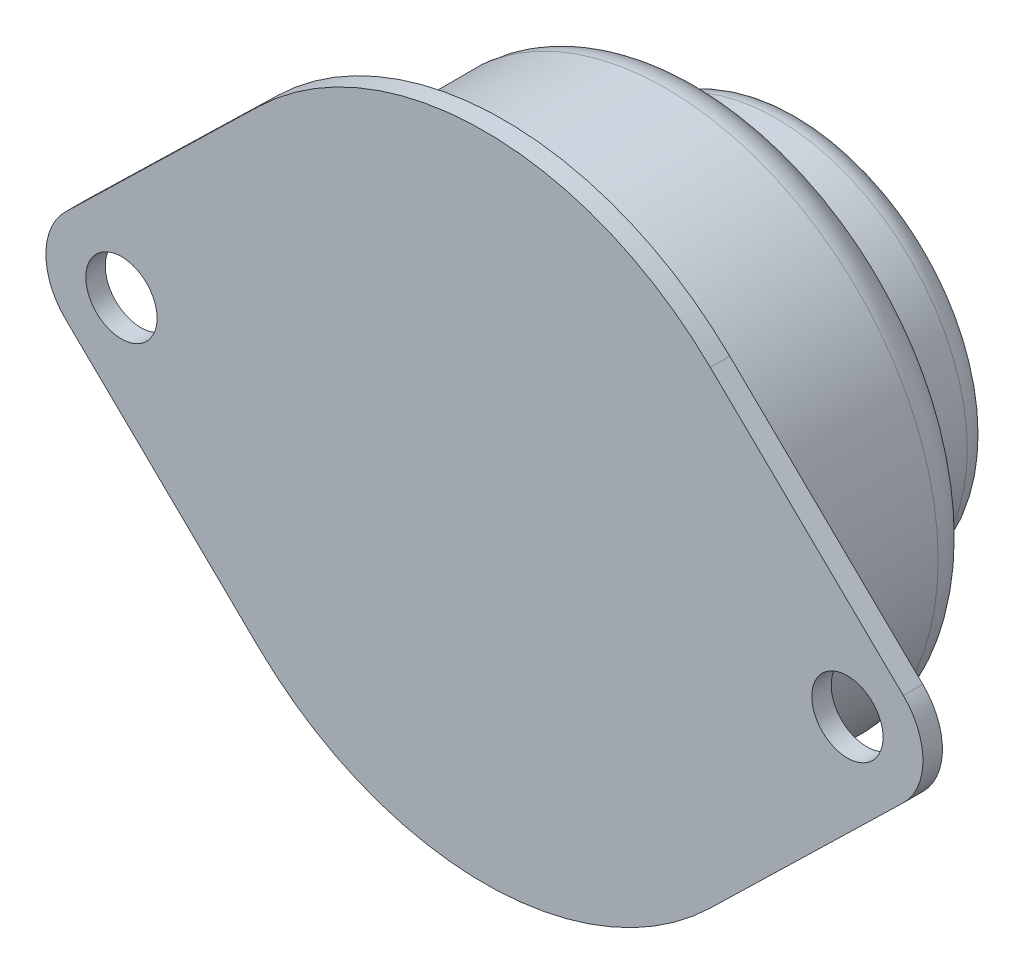
from build123d import *

# Parameters (mm, degrees)
SKETCH_2_R      = 2.75
EXTRUDE_1_DEPTH = 1.5
SKETCH_3_R      = 21
EXTRUDE_2_DEPTH = 17
FILLET_4_R      = 3
SKETCH_6_R      = 14.75
EXTRUDE_3_DEPTH = 7.5
FILLET_3_R      = 2
FILLET_7_R      = 25
FILLET_8_R      = 5


with BuildPart() as part:
    # ｽｹｯﾁ2 → ﾎﾞｽ - 押し出し1 (new body)
    with BuildSketch(Plane.XY):
        Polygon((0, -35), (-36, 0), (0, 35), (36, 0), align=None)
        with Locations((-28, 0)):
            Circle(SKETCH_2_R, mode=Mode.SUBTRACT)
        with Locations((28, 0)):
            Circle(SKETCH_2_R, mode=Mode.SUBTRACT)
    extrude(amount=EXTRUDE_1_DEPTH)

    # ｽｹｯﾁ3 → ﾎﾞｽ - 押し出し2 (add)
    with BuildSketch(Plane.XY.offset(1.5)):
        Circle(SKETCH_3_R)
    extrude(amount=-EXTRUDE_2_DEPTH)

    # ﾌｨﾚｯﾄ4
    fillet_4_edges = [part.edges().sort_by_distance(p)[0] for p in [
        (-21, 0, -15.5),
    ]]
    fillet(fillet_4_edges, radius=FILLET_4_R)

    # ｽｹｯﾁ5 → 回転1 (revolve)
    with BuildSketch(Plane(origin=(0, 0, -16.8), x_dir=(-1, 0, 0), z_dir=(0, 0, -1))):
        with BuildLine():
            Line((0, 12.7), (0, -12.7))
            ThreePointArc((0, -12.7), (-12.7, 0), (0, 12.7))
        make_face()
    revolve(axis=Axis((0, -12.7, -16.8), (0, 1, 0)))

    # ｽｹｯﾁ6 → ﾎﾞｽ - 押し出し3 (add)
    with BuildSketch(Plane(origin=(0, 0, -15.5), x_dir=(-1, 0, 0), z_dir=(0, 0, -1))):
        with Locations(Location((0, 0, 0), (0, 0, 180))):
            Circle(SKETCH_6_R)
    extrude(amount=EXTRUDE_3_DEPTH)

    # ﾌｨﾚｯﾄ3
    fillet_3_edges = [part.edges().sort_by_distance(p)[0] for p in [
        (-14.75, 0, -23),
    ]]
    fillet(fillet_3_edges, radius=FILLET_3_R)

    # ﾌｨﾚｯﾄ7
    fillet_7_edges = [part.edges().sort_by_distance(p)[0] for p in [
        (0, 35, 0.75),
        (0, -35, 0.75),
    ]]
    fillet(fillet_7_edges, radius=FILLET_7_R)

    # ﾌｨﾚｯﾄ8
    fillet_8_edges = [part.edges().sort_by_distance(p)[0] for p in [
        (36, 0, 0.75),
        (-36, 0, 0.75),
    ]]
    fillet(fillet_8_edges, radius=FILLET_8_R)


solid = part.part
